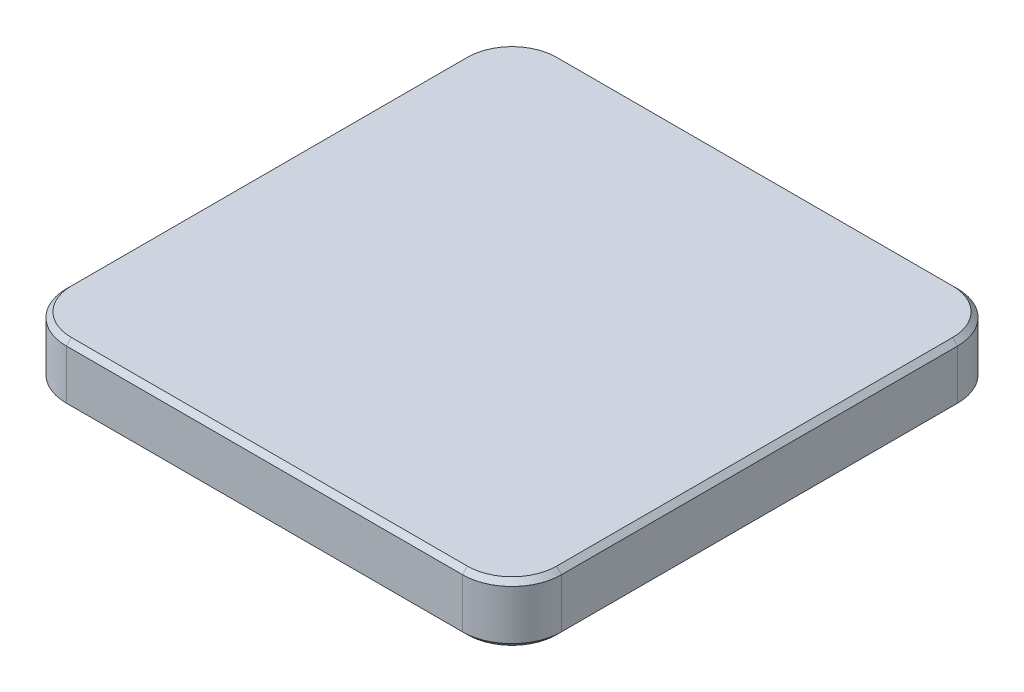
from build123d import *

# Parameters (mm, degrees)
BOSS_EXTRUDE1_DEPTH = 12
CHAMFER1_SIZE       = 1


with BuildPart() as part:
    # Sketch2 → Boss-Extrude1 (new body)
    with BuildSketch(Plane(origin=(0, 0, 0), x_dir=(1, 0, 0), z_dir=(0, 1, 0))):
        with BuildLine():
            Line((-50, 40), (-50, -40))
            ThreePointArc((-50, -40), (-47.071067812, -47.071067812), (-40, -50))
            Line((-40, -50), (40, -50))
            ThreePointArc((40, -50), (47.071067812, -47.071067812), (50, -40))
            Line((50, -40), (50, 40))
            ThreePointArc((50, 40), (47.071067812, 47.071067812), (40, 50))
            Line((40, 50), (-40, 50))
            ThreePointArc((-40, 50), (-47.071067812, 47.071067812), (-50, 40))
        make_face()
    extrude(amount=BOSS_EXTRUDE1_DEPTH)

    # Chamfer1
    chamfer1_edges = [part.edges().sort_by_distance(p)[0] for p in [
        (0, 0, -50),
        (47.071067812, 0, -47.071067812),
        (50, 0, 0),
        (47.071067812, 0, 47.071067812),
        (47.071067812, 12, -47.071067812),
        (0, 12, -50),
        (-47.071067812, 12, -47.071067812),
        (-50, 12, 0),
        (-47.071067812, 12, 47.071067812),
        (0, 12, 50),
        (47.071067812, 12, 47.071067812),
        (0, 0, 50),
        (50, 12, 0),
        (-47.071067812, 0, 47.071067812),
        (-50, 0, 0),
        (-47.071067812, 0, -47.071067812),
    ]]
    chamfer(chamfer1_edges, length=CHAMFER1_SIZE)


solid = part.part
